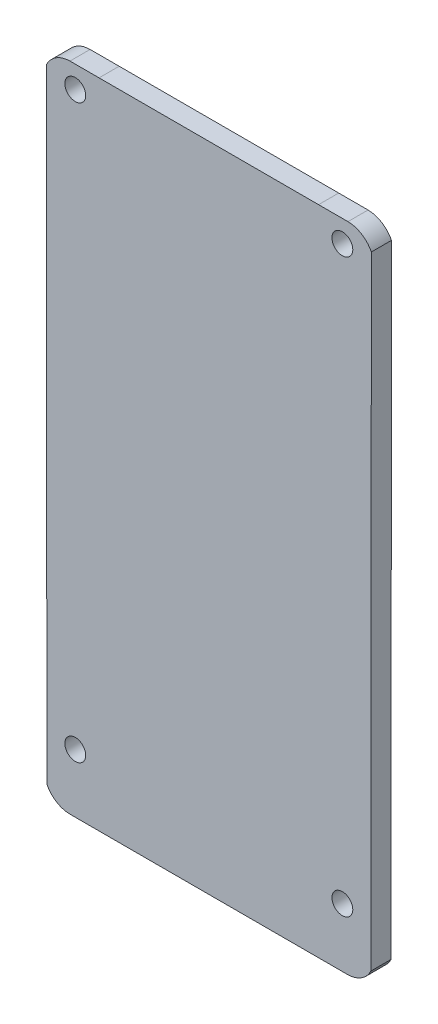
from build123d import *

# Parameters (mm, degrees)
BOSS_EXTRUDE1_DEPTH     = 2.75
CUT_EXTRUDE1_DEPTH      = 50.877740599
CUT_EXTRUDE1_DEPTH_BACK = 50.877740599
SKETCH2_R               = 1.425


with BuildPart() as part:
    # Sketch1 → Boss-Extrude1 (new body)
    with BuildSketch(Plane(origin=(0, 0, 0), x_dir=(-1, 0, 0), z_dir=(0, 0, 1))):
        with BuildLine():
            Line((19.026354954, 44.565132863), (15.00001057, 44.566877537))
            Line((15.00001057, 44.566877537), (-15.000000006, 44.573221717))
            Line((-15.000000006, 44.573221717), (-19.026379978, 44.573180573))
            ThreePointArc((-19.026379978, 44.573180573), (-20.866998297, 44.012105117), (-22.144784315, 42.573375))
            Line((-22.144784315, 42.573375), (-22.212600147, -42.573375))
            ThreePointArc((-22.212600147, -42.573375), (-20.89165665, -44.017987624), (-19.012374049, -44.565796226))
            Line((-19.012374049, -44.565796226), (-15.000008938, -44.567395648))
            Line((-15.000008938, -44.567395648), (15, -44.573739828))
            Line((15, -44.573739828), (18.975450836, -44.573836518))
            ThreePointArc((18.975450836, -44.573836518), (20.859429803, -44.024042544), (22.18125197, -42.573375))
            Line((22.18125197, -42.573375), (22.139374041, 42.573375))
            ThreePointArc((22.139374041, 42.573375), (20.862361619, 44.006094116), (19.026354954, 44.565132863))
        make_face()
    extrude(amount=BOSS_EXTRUDE1_DEPTH)

    # Sketch2 → Cut-Extrude1 (cut, two sides: drawn at the far end of the back side and taken through both)
    with BuildSketch(Plane.XY.offset(2.75).offset(-CUT_EXTRUDE1_DEPTH_BACK)):
        with Locations((-18.25, 41.565796226)):
            Circle(SKETCH2_R)
        with Locations((18.25, 41.565796226)):
            Circle(SKETCH2_R)
        with Locations((18.25, -36.534203774)):
            Circle(SKETCH2_R)
        with Locations((-18.25, -36.534203774)):
            Circle(SKETCH2_R)
    extrude(amount=CUT_EXTRUDE1_DEPTH + CUT_EXTRUDE1_DEPTH_BACK, mode=Mode.SUBTRACT)


solid = part.part
